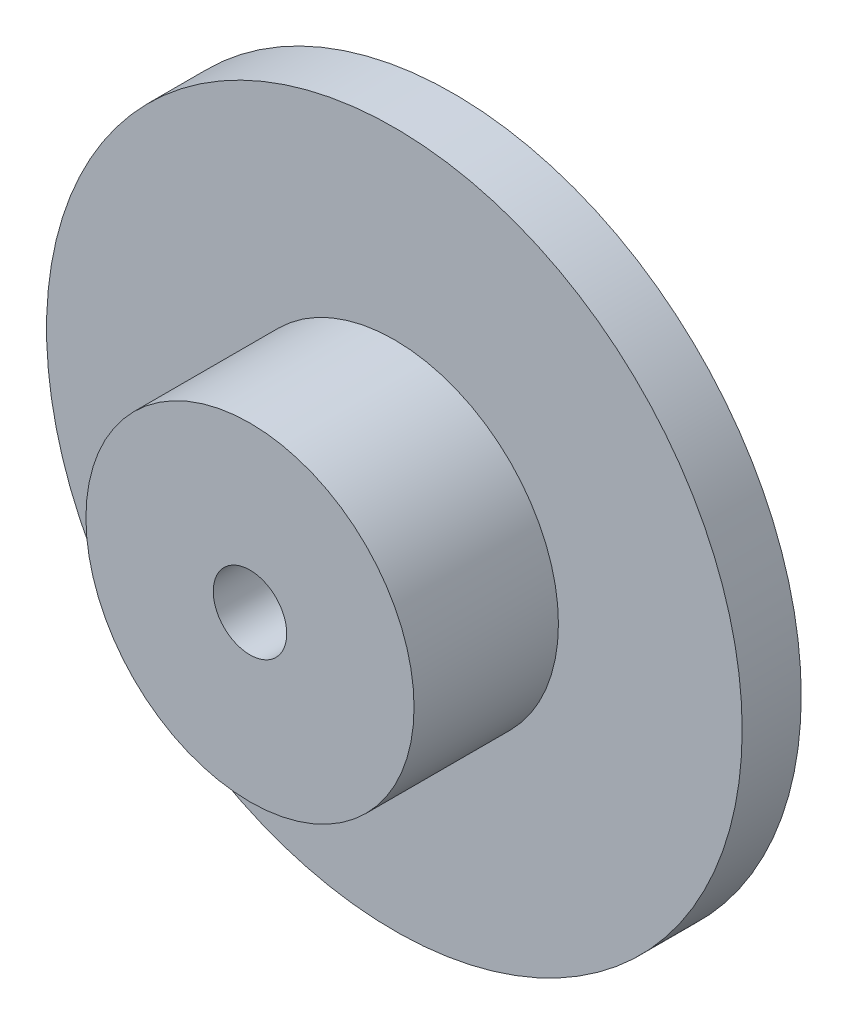
from build123d import *

# Parameters (mm, degrees)
ESQUISSE1_R        = 26.5
ESQUISSE1_R_2      = 3
BOSS_EXTRU_1_DEPTH = 4.5
ESQUISSE2_R        = 12.5
ESQUISSE2_R_2      = 2.8
BOSS_EXTRU_2_DEPTH = 11


with BuildPart() as part:
    # Esquisse1 → Boss.-Extru.1 (new body)
    with BuildSketch(Plane.XY):
        Circle(ESQUISSE1_R)
        Circle(ESQUISSE1_R_2, mode=Mode.SUBTRACT)
    extrude(amount=-BOSS_EXTRU_1_DEPTH)

    # Esquisse2 → Boss.-Extru.2 (add)
    with BuildSketch(Plane.XY):
        Circle(ESQUISSE2_R)
        Circle(ESQUISSE2_R_2, mode=Mode.SUBTRACT)
    extrude(amount=BOSS_EXTRU_2_DEPTH)


solid = part.part
